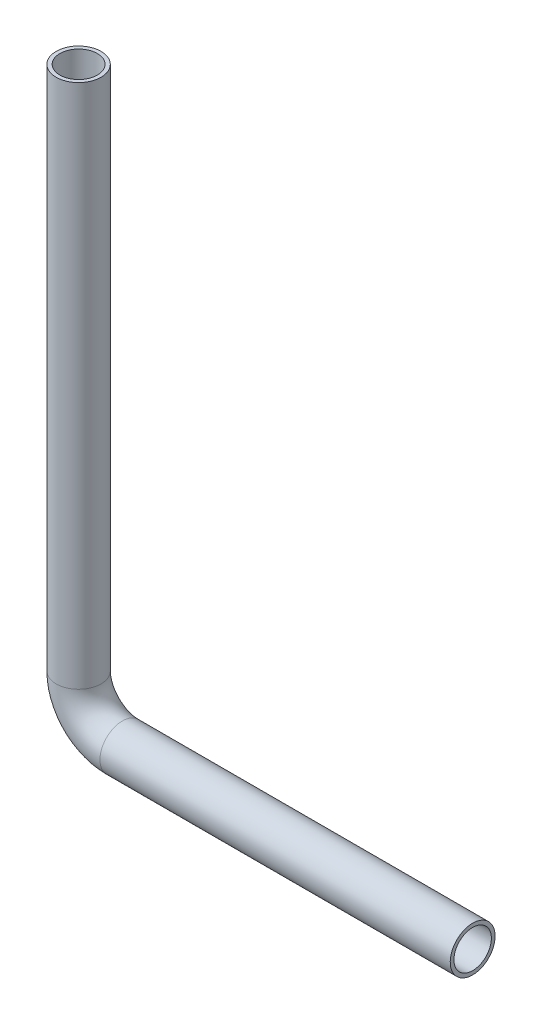
from build123d import *

# Parameters (mm, degrees)
ESBO_O6_R                 = 10.25
ESBO_O6_R_2               = 8.55
FURO_ROSCADO_DE_M61_D     = 5
FURO_ROSCADO_DE_M61_DEPTH = 15
FURO_ROSCADO_DE_M61_TIP   = 1.502151548


with BuildPart() as part:
    # Varredura1: sweep along a path in Esboço5
    with BuildLine(Plane.XY) as varredura1_path:
        Line((0, 0), (-160, 0))
        ThreePointArc((-160, 0), (-174.142135624, 5.857864376), (-180, 20))
        Line((-180, 20), (-180, 260))
    # Esboço6 → Varredura1 (sweep)
    with BuildSketch(Plane.ZY):
        Circle(ESBO_O6_R)
        Circle(ESBO_O6_R_2, mode=Mode.SUBTRACT)
    sweep(path=varredura1_path.line)

    # Furo roscado de M61
    with Locations(Plane.ZY.offset(195)):
        with Locations((0, 240), (0, 215), (0, 190), (0, 165)):
            Hole(FURO_ROSCADO_DE_M61_D / 2, depth=FURO_ROSCADO_DE_M61_DEPTH)
            with Locations((0, 0, -(FURO_ROSCADO_DE_M61_DEPTH + FURO_ROSCADO_DE_M61_TIP / 2))):  # 118° drill point
                Cone(0, FURO_ROSCADO_DE_M61_D / 2, FURO_ROSCADO_DE_M61_TIP, mode=Mode.SUBTRACT)


solid = part.part
